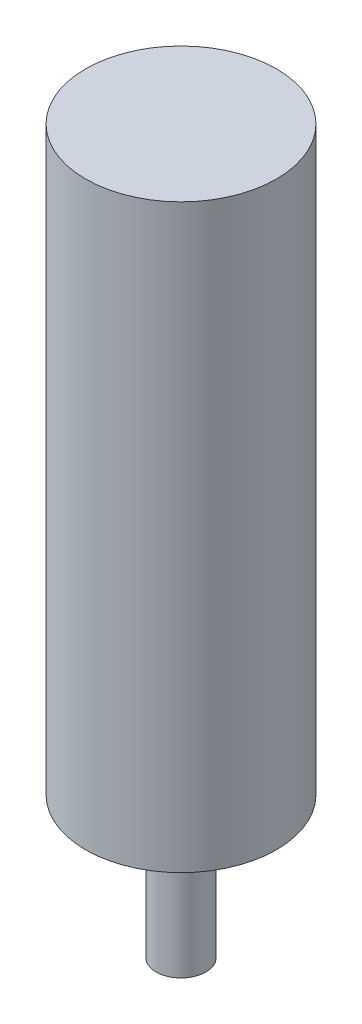
from build123d import *

# Parameters (mm, degrees)
SKETCH1_R      = 11.5
EXTRUDE1_DEPTH = 70
SKETCH2_R      = 7.5
EXTRUDE2_DEPTH = 1
SKETCH3_R      = 3
EXTRUDE3_DEPTH = 16


with BuildPart() as part:
    # Sketch1 → Extrude1 (new body)
    with BuildSketch(Plane(origin=(0, 0, 0), x_dir=(1, 0, 0), z_dir=(0, 1, 0))):
        with Locations(Location((0, 0, 0), (0, 0, 270))):
            Circle(SKETCH1_R)
    extrude(amount=EXTRUDE1_DEPTH)

    # Sketch2 → Extrude2 (add)
    with BuildSketch(Plane.XZ):
        with Locations(Location((0, 0, 0), (0, 0, 90))):
            Circle(SKETCH2_R)
    extrude(amount=EXTRUDE2_DEPTH)

    # Sketch3 → Extrude3 (add)
    with BuildSketch(Plane.XZ.offset(1)):
        with Locations(Location((0, 0, 0), (0, 0, 270))):
            Circle(SKETCH3_R)
    extrude(amount=EXTRUDE3_DEPTH)


solid = part.part
